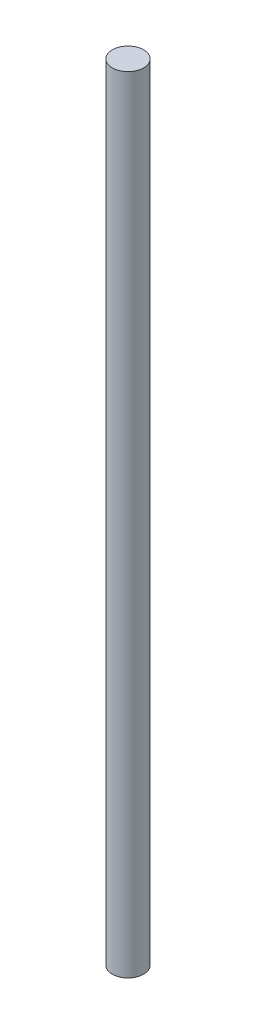
from build123d import *

# Parameters (mm, degrees)
SKETCH_1_R      = 1.6
EXTRUDE_1_DEPTH = 80


with BuildPart() as part:
    # 草图1 → 凸台-拉伸1 (new body)
    with BuildSketch(Plane(origin=(0, 0, 0), x_dir=(1, 0, 0), z_dir=(0, 1, 0))):
        with Locations(Location((0, 0, 0), (0, 0, 270))):
            Circle(SKETCH_1_R)
    extrude(amount=EXTRUDE_1_DEPTH)


solid = part.part
